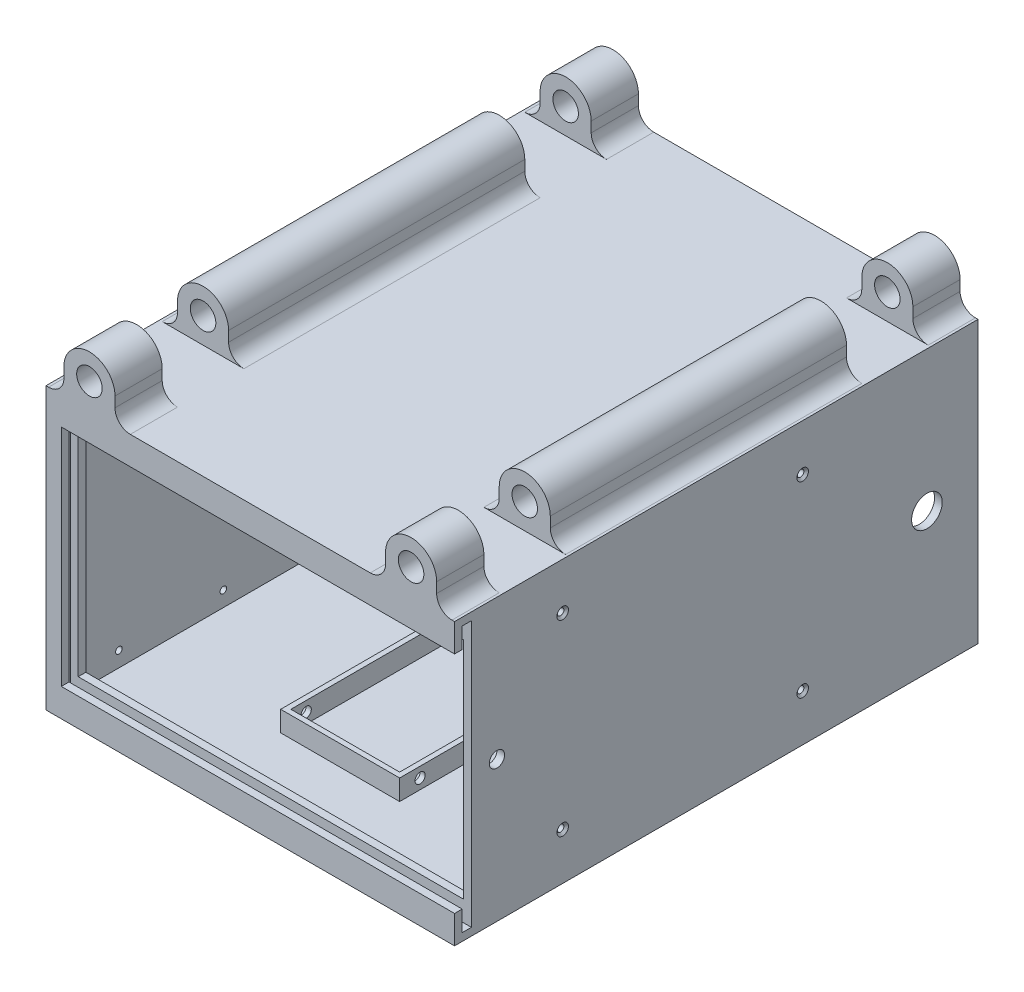
from build123d import *

# Parameters (mm, degrees)
SKETCH1_R                        = 6.35
BODY_EXTRUDE_DEPTH               = 260.35
ATTACHMENT_FILLET_R              = 7.62
BACK_DOOR_CUT_DEPTH              = 199.39
SKETCH4_3_W                      = 3.81
SKETCH4_3_H                      = 111.76
BACK_DOOR_CUT_2_DEPTH            = 195.58
FRONT_DOOR_CUT_START             = -3.81
SKETCH4_5_W                      = 4.572
SKETCH4_5_H                      = 132.08
FRONT_DOOR_CUT_DEPTH             = 340.912162509
FRONT_DOOR_CUT_2_START           = -7.62
SKETCH4_6_W                      = 3.81
SKETCH4_6_H                      = 111.76
FRONT_DOOR_CUT_2_DEPTH           = 337.102162509
SKETCH5_W                        = 203.2
SKETCH5_H                        = 33.02
STOPPER_CUT_DEPTH                = 313.443230844
SKETCH6_W                        = 195.58
SKETCH6_H                        = 132.08
HOLLOW_CUT_DEPTH                 = 243.586
SKETCH7_W                        = 3.81
SKETCH7_H                        = 10.16
INNER_RAIL_EXTRUDE_DEPTH         = 195.58
BATTERY_RAILS_EXTRUDE_DEPTH      = 10.16
BATTERY_RAIL_HOLES_CUT_REACH     = 308.701
SKETCH12_R                       = 2.54
USRP_HOLES_D                     = 3.2639
USRP_HOLES_DEPTH                 = 3.81
USRP_HOLES_CSINK_D               = 5.715
USRP_HOLES_CSINK_ANGLE           = 100
JETSON_HOLES_D                   = 3.2639
JETSON_HOLES_DEPTH               = 3.81
JETSON_HOLES_CSINK_D             = 5.715
JETSON_HOLES_CSINK_ANGLE         = 100
CUI_HOLES_D                      = 3.2639
CUI_HOLES_DEPTH                  = 3.81
CUI_HOLES_CSINK_D                = 5.715
CUI_HOLES_CSINK_ANGLE            = 100
SKETCH19_W                       = 7.62
SKETCH19_H                       = 3.81
INNER_DOOR_STOPPERS_DEPTH        = 135.89
TERMINAL_BLOCK_HOLES_D           = 3.2639
TERMINAL_BLOCK_HOLES_DEPTH       = 3.81
TERMINAL_BLOCK_HOLES_CSINK_D     = 5.715
TERMINAL_BLOCK_HOLES_CSINK_ANGLE = 100
SKETCH23_R                       = 3.81
SKETCH23_R_2                     = 7.62
MARINE_SEAL_DEPTH                = 3.81


with BuildPart() as part:
    # Sketch1 → body_extrude (new body)
    with BuildSketch(Plane.XY):
        with BuildLine():
            Line((-92.6973, 69.85), (-92.6973, 82.55))
            ThreePointArc((-92.6973, 82.55), (-79.9973, 95.25), (-67.2973, 82.55))
            Line((-67.2973, 82.55), (-67.2973, 69.85))
            Line((-67.2973, 69.85), (67.2973, 69.85))
            Line((67.2973, 69.85), (67.2973, 82.55))
            ThreePointArc((67.2973, 82.55), (79.9973, 95.25), (92.6973, 82.55))
            Line((92.6973, 82.55), (92.6973, 69.85))
            Line((92.6973, 69.85), (101.6, 69.85))
            Line((101.6, 69.85), (101.6, -69.85))
            Line((101.6, -69.85), (-101.6, -69.85))
            Line((-101.6, -69.85), (-101.6, 69.85))
            Line((-101.6, 69.85), (-92.6973, 69.85))
        make_face()
        with Locations((-79.9973, 82.55)):
            Circle(SKETCH1_R, mode=Mode.SUBTRACT)
        with Locations(Location((79.9973, 82.55, 0), (0, 0, 180))):
            Circle(SKETCH1_R, mode=Mode.SUBTRACT)
    extrude(amount=BODY_EXTRUDE_DEPTH)

    # attachment_fillet
    attachment_fillet_edges = [part.edges().sort_by_distance(p)[0] for p in [
        (-92.6973, 69.85, 130.175),
        (-67.2973, 69.85, 130.175),
        (67.2973, 69.85, 130.175),
        (92.6973, 69.85, 130.175),
    ]]
    fillet(attachment_fillet_edges, radius=ATTACHMENT_FILLET_R)

    # Sketch4 → back_door_cut (cut)
    with BuildSketch(Plane.ZY.offset(101.6)):
        Polygon((3.81, 55.88), (3.81, -55.88), (3.81, -66.04), (8.382, -66.04), (8.382, 66.04), (3.81, 66.04), align=None)
    extrude(amount=-BACK_DOOR_CUT_DEPTH, mode=Mode.SUBTRACT)

    # Sketch4<3> → back_door_cut_2 (cut)
    with BuildSketch(Plane.ZY.offset(101.6)):
        with Locations((1.905, 0)):
            Rectangle(SKETCH4_3_W, SKETCH4_3_H)
    extrude(amount=-BACK_DOOR_CUT_2_DEPTH, mode=Mode.SUBTRACT)

    # Sketch4<5> → front_door_cut (cut, through all)
    with BuildSketch(Plane.ZY.offset(101.6).offset(FRONT_DOOR_CUT_START)):
        with Locations((254.254, 0)):
            Rectangle(SKETCH4_5_W, SKETCH4_5_H)
    extrude(amount=-FRONT_DOOR_CUT_DEPTH, mode=Mode.SUBTRACT)

    # Sketch4<6> → front_door_cut_2 (cut, through all)
    with BuildSketch(Plane.ZY.offset(101.6).offset(FRONT_DOOR_CUT_2_START)):
        with Locations((258.445, 0)):
            Rectangle(SKETCH4_6_W, SKETCH4_6_H)
    extrude(amount=-FRONT_DOOR_CUT_2_DEPTH, mode=Mode.SUBTRACT)

    # Sketch5 → stopper_cut (cut, through all)
    with BuildSketch(Plane(origin=(0, 69.85, 0), x_dir=(1, 0, 0), z_dir=(0, 1, 0))):
        with Locations((0, -40.005)):
            Rectangle(SKETCH5_W, SKETCH5_H)
        with Locations((0, -220.345)):
            Rectangle(SKETCH5_W, SKETCH5_H)
    extrude(amount=STOPPER_CUT_DEPTH, mode=Mode.SUBTRACT)

    # Sketch6 → hollow_cut (cut)
    with BuildSketch(Plane(origin=(0, 0, 8.382), x_dir=(-1, 0, 0), z_dir=(0, 0, -1))):
        Rectangle(SKETCH6_W, SKETCH6_H)
    extrude(amount=-HOLLOW_CUT_DEPTH, mode=Mode.SUBTRACT)

    # Sketch7 → inner_rail_extrude (add)
    with BuildSketch(Plane.ZY.offset(97.79)):
        with Locations((10.287, -60.96)):
            Rectangle(SKETCH7_W, SKETCH7_H)
        with Locations((10.287, 60.96)):
            Rectangle(SKETCH7_W, SKETCH7_H)
        with Locations((250.063, -60.96)):
            Rectangle(SKETCH7_W, SKETCH7_H)
        with Locations((250.063, 60.96)):
            Rectangle(SKETCH7_W, SKETCH7_H)
    extrude(amount=-INNER_RAIL_EXTRUDE_DEPTH)

    # Sketch11 → battery_rails_extrude (add)
    with BuildSketch(Plane.XZ.offset(66.04)):
        Polygon((-27.051, 213.106), (27.051, 213.106), (27.051, 47.244), (27.051, 44.704), (29.591, 44.704), (29.591, 215.646), (-29.591, 215.646), (-29.591, 44.704), (-27.051, 44.704), (-27.051, 47.244), align=None)
    extrude(amount=-BATTERY_RAILS_EXTRUDE_DEPTH)

    # battery_rail_holes_cut: up to this face of the body (flat: up to its plane)
    battery_rail_holes_cut_end = Plane(part.part.faces().sort_by_distance((29.591, -60.96, 130.175))[0])
    # Sketch12 → battery_rail_holes_cut (cut, up to the picked face)
    with BuildSketch(Plane.ZY.offset(29.591), mode=Mode.PRIVATE) as battery_rail_holes_cut_sk1:
        with Locations((54.864, -60.96)):
            Circle(SKETCH12_R)
    battery_rail_holes_cut_tool1 = split(extrude(battery_rail_holes_cut_sk1.sketch, amount=-BATTERY_RAIL_HOLES_CUT_REACH, mode=Mode.PRIVATE), bisect_by=battery_rail_holes_cut_end, keep=Keep.BOTH, mode=Mode.PRIVATE)
    # Sketch12 → battery_rail_holes_cut (cut, up to the picked face)
    with BuildSketch(Plane.ZY.offset(29.591), mode=Mode.PRIVATE) as battery_rail_holes_cut_sk2:
        with Locations((130.175, -60.96)):
            Circle(SKETCH12_R)
    battery_rail_holes_cut_tool2 = split(extrude(battery_rail_holes_cut_sk2.sketch, amount=-BATTERY_RAIL_HOLES_CUT_REACH, mode=Mode.PRIVATE), bisect_by=battery_rail_holes_cut_end, keep=Keep.BOTH, mode=Mode.PRIVATE)
    # Sketch12 → battery_rail_holes_cut (cut, up to the picked face)
    with BuildSketch(Plane.ZY.offset(29.591), mode=Mode.PRIVATE) as battery_rail_holes_cut_sk3:
        with Locations((205.486, -60.96)):
            Circle(SKETCH12_R)
    battery_rail_holes_cut_tool3 = split(extrude(battery_rail_holes_cut_sk3.sketch, amount=-BATTERY_RAIL_HOLES_CUT_REACH, mode=Mode.PRIVATE), bisect_by=battery_rail_holes_cut_end, keep=Keep.BOTH, mode=Mode.PRIVATE)
    add(battery_rail_holes_cut_tool1.solids().sort_by(Axis((-29.591, -60.96, 54.864), (1, 0, 0)))[0], mode=Mode.SUBTRACT)
    add(battery_rail_holes_cut_tool2.solids().sort_by(Axis((-29.591, -60.96, 130.175), (1, 0, 0)))[0], mode=Mode.SUBTRACT)
    add(battery_rail_holes_cut_tool3.solids().sort_by(Axis((-29.591, -60.96, 205.486), (1, 0, 0)))[0], mode=Mode.SUBTRACT)

    # usrp_holes
    with Locations(Plane(origin=(101.6, 0, 0), x_dir=(0, 0, -1), z_dir=(1, 0, 0))):
        with Locations((-87.1982, 46.609), (-206.5528, 46.609), (-206.5528, -46.609), (-87.1982, -46.609)):
            CounterSinkHole(USRP_HOLES_D / 2, USRP_HOLES_CSINK_D / 2, depth=USRP_HOLES_DEPTH, counter_sink_angle=USRP_HOLES_CSINK_ANGLE)

    # jetson_holes
    with Locations(Plane.ZY.offset(101.6)):
        with Locations((175.9712, -58.4454), (175.9712, 58.4454), (227.8888, 58.4454), (227.8888, -58.4454)):
            CounterSinkHole(JETSON_HOLES_D / 2, JETSON_HOLES_CSINK_D / 2, depth=JETSON_HOLES_DEPTH, counter_sink_angle=JETSON_HOLES_CSINK_ANGLE)

    # cui_holes
    with Locations(Plane.ZY.offset(101.6)):
        with Locations((99.822, -21.336), (38.1, -44.45)):
            CounterSinkHole(CUI_HOLES_D / 2, CUI_HOLES_CSINK_D / 2, depth=CUI_HOLES_DEPTH, counter_sink_angle=CUI_HOLES_CSINK_ANGLE)

    # Sketch19 → inner_door_stoppers (add)
    with BuildSketch(Plane.XZ.offset(69.85)):
        with Locations((97.79, 10.287)):
            Rectangle(SKETCH19_W, SKETCH19_H)
        with Locations((-97.79, 250.063)):
            Rectangle(SKETCH19_W, SKETCH19_H)
    extrude(amount=-INNER_DOOR_STOPPERS_DEPTH)

    # terminal_block_holes
    with Locations(Plane.ZY.offset(101.6)):
        with Locations((55.1815, 1.27), (46.4185, 30.353)):
            CounterSinkHole(TERMINAL_BLOCK_HOLES_D / 2, TERMINAL_BLOCK_HOLES_CSINK_D / 2, depth=TERMINAL_BLOCK_HOLES_DEPTH, counter_sink_angle=TERMINAL_BLOCK_HOLES_CSINK_ANGLE)

    # Sketch23 → marine_seal (cut)
    with BuildSketch(Plane(origin=(101.6, 0, 0), x_dir=(0, 0, -1), z_dir=(1, 0, 0))):
        with Locations(Location((-239.268, 0, 0), (0, 0, 90))):
            Circle(SKETCH23_R)
        with Locations(Location((-25.4, 0, 0), (0, 0, 90))):
            Circle(SKETCH23_R_2)
    extrude(amount=-MARINE_SEAL_DEPTH, mode=Mode.SUBTRACT)


solid = part.part
